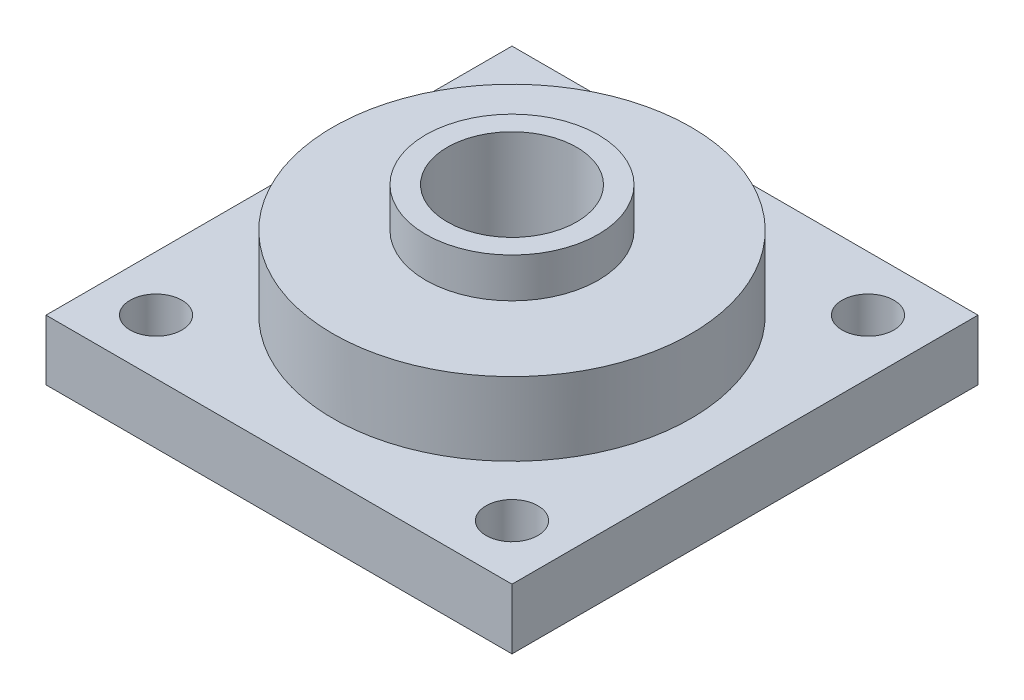
from build123d import *

# Parameters (mm, degrees)
SKETCH1_W           = 108
SKETCH1_H           = 108
SKETCH1_R           = 6
SKETCH1_R_2         = 15
BOSS_EXTRUDE1_DEPTH = 14
SKETCH2_R           = 20
SKETCH2_R_2         = 15
BOSS_EXTRUDE2_DEPTH = 26.2
SKETCH3_R           = 41.5
SKETCH3_R_2         = 15
BOSS_EXTRUDE3_DEPTH = 17


with BuildPart() as part:
    # Sketch1 → Boss-Extrude1 (new body)
    with BuildSketch(Plane(origin=(0, 0, 0), x_dir=(1, 0, 0), z_dir=(0, 1, 0))):
        with Locations((54, 54)):
            Rectangle(SKETCH1_W, SKETCH1_H)
        with Locations(Location((12.75, 12.75, 0), (0, 0, 270))):
            Circle(SKETCH1_R, mode=Mode.SUBTRACT)
        with Locations(Location((54, 54, 0), (0, 0, 270))):
            Circle(SKETCH1_R_2, mode=Mode.SUBTRACT)
        with Locations(Location((95.25, 12.75, 0), (0, 0, 270))):
            Circle(SKETCH1_R, mode=Mode.SUBTRACT)
        with Locations(Location((95.25, 95.25, 0), (0, 0, 270))):
            Circle(SKETCH1_R, mode=Mode.SUBTRACT)
        with Locations(Location((12.75, 95.25, 0), (0, 0, 270))):
            Circle(SKETCH1_R, mode=Mode.SUBTRACT)
    extrude(amount=BOSS_EXTRUDE1_DEPTH)

    # Sketch2 → Boss-Extrude2 (add)
    with BuildSketch(Plane(origin=(0, 14, 0), x_dir=(1, 0, 0), z_dir=(0, 1, 0))):
        with Locations(Location((54, 54, 0), (0, 0, 90))):
            Circle(SKETCH2_R)
        with Locations(Location((54, 54, 0), (0, 0, 270))):
            Circle(SKETCH2_R_2, mode=Mode.SUBTRACT)
    extrude(amount=BOSS_EXTRUDE2_DEPTH)

    # Sketch3 → Boss-Extrude3 (add)
    with BuildSketch(Plane(origin=(0, 14, 0), x_dir=(1, 0, 0), z_dir=(0, 1, 0))):
        with Locations(Location((54, 54, 0), (0, 0, 90))):
            Circle(SKETCH3_R)
        with Locations(Location((54, 54, 0), (0, 0, 270))):
            Circle(SKETCH3_R_2, mode=Mode.SUBTRACT)
    extrude(amount=BOSS_EXTRUDE3_DEPTH)


solid = part.part
